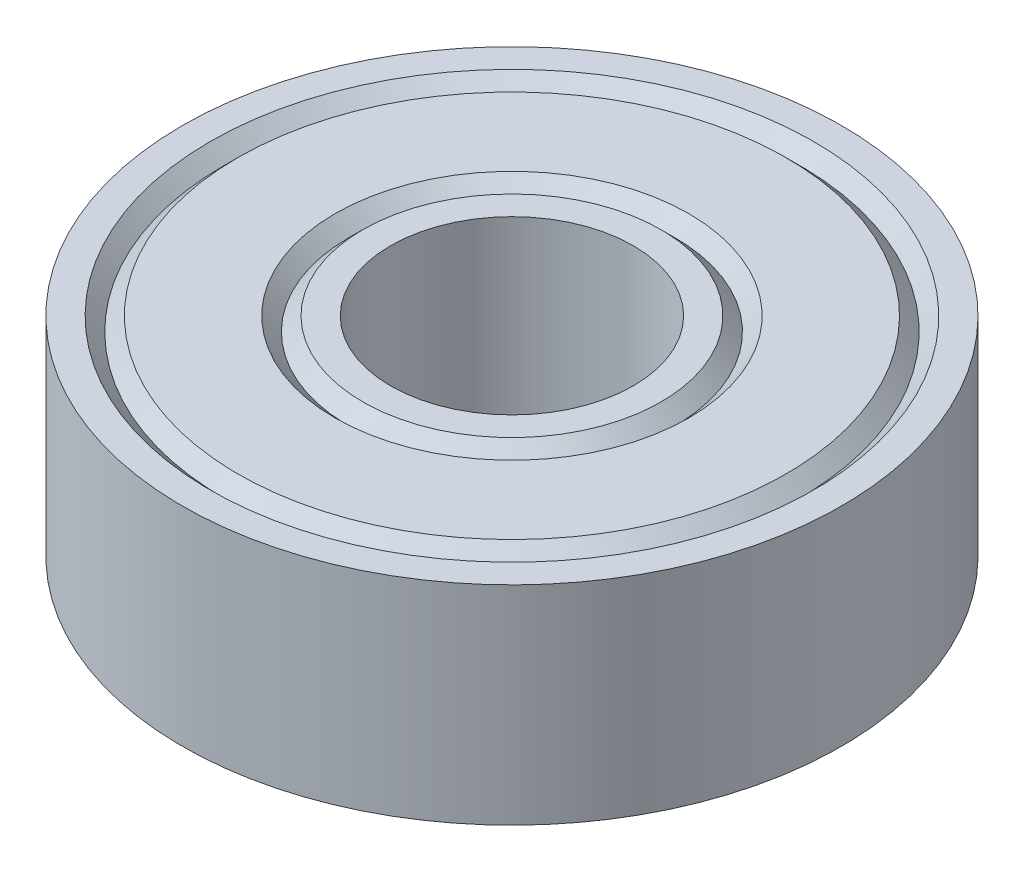
from build123d import *


with BuildPart() as part:
    # Sketch1 → Revolve1 (revolve)
    with BuildSketch(Plane.XY):
        Polygon((-3.5, 3), (-4.3, 3), (-4.7, 2.6), (-5.1, 3), (-7.9, 3), (-8.3, 2.6), (-8.7, 3), (-9.5, 3), (-9.5, -3), (-8.7, -3), (-8.3, -2.6), (-7.9, -3), (-5.1, -3), (-4.7, -2.6), (-4.3, -3), (-3.5, -3), align=None)
    revolve(axis=Axis((0, 3, 0), (0, -1, 0)))


solid = part.part
